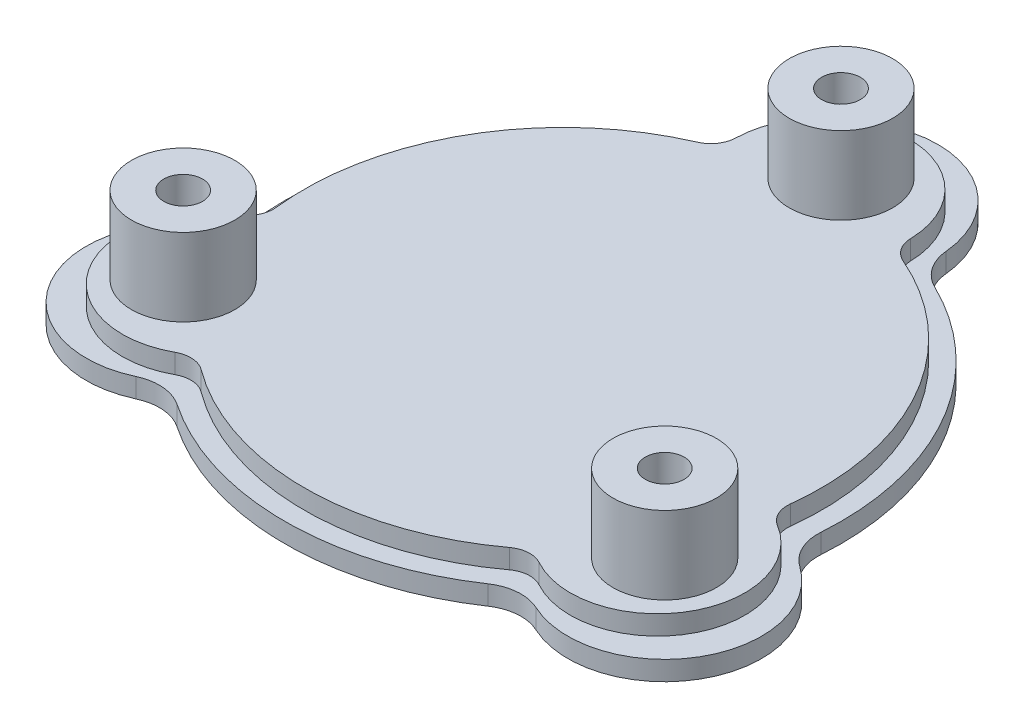
from build123d import *

# Parameters (mm, degrees)
SKETCH1_R           = 6
SKETCH1_R_2         = 3
BOSS_EXTRUDE1_DEPTH = 3
SKETCH3_R           = 3
BOSS_EXTRUDE3_DEPTH = 3
SKETCH4_R           = 8
SKETCH4_R_2         = 3
BOSS_EXTRUDE4_DEPTH = 12
SKETCH6_R           = 8
SKETCH6_R_2         = 3
BOSS_EXTRUDE5_DEPTH = 12


with BuildPart() as part:
    # Sketch1 → Boss-Extrude1 (new body)
    # profile 1 of 4: a face of its own
    with BuildSketch(Plane(origin=(0, 0, 0), x_dir=(1, 0, 0), z_dir=(0, 1, 0))):
        with BuildLine():
            ThreePointArc((42.894958583, -3.003752345), (43.557934635, -6.502479184), (45.856433127, -9.222319513))
            ThreePointArc((45.856433127, -9.222319513), (50.229473419, -29), (30.914979544, -35.101676259))
            ThreePointArc((30.914979544, -35.101676259), (27.410279478, -34.471038339), (24.048805129, -35.646247655))
            ThreePointArc((24.048805129, -35.646247655), (0, -43), (-24.048805129, -35.646247655))
            ThreePointArc((-24.048805129, -35.646247655), (-27.410279478, -34.471038339), (-30.914979544, -35.101676259))
            ThreePointArc((-30.914979544, -35.101676259), (-50.229473419, -29), (-45.856433127, -9.222319513))
            ThreePointArc((-45.856433127, -9.222319513), (-43.557934635, -6.502479184), (-42.894958583, -3.003752345))
            ThreePointArc((-42.894958583, -3.003752345), (-37.239092363, 21.5), (-18.846153454, 38.65))
            ThreePointArc((-18.846153454, 38.65), (-16.147655157, 40.973517523), (-14.941453584, 44.323995772))
            ThreePointArc((-14.941453584, 44.323995772), (0, 58), (14.941453584, 44.323995772))
            ThreePointArc((14.941453584, 44.323995772), (16.147655157, 40.973517523), (18.846153454, 38.65))
            ThreePointArc((18.846153454, 38.65), (37.239092363, 21.5), (42.894958583, -3.003752345))
        make_face()
        with Locations((37.239092363, -21.5)):
            Circle(SKETCH1_R, mode=Mode.SUBTRACT)
        with Locations((-37.239092363, -21.5)):
            Circle(SKETCH1_R, mode=Mode.SUBTRACT)
        with Locations((0, 43)):
            Circle(SKETCH1_R, mode=Mode.SUBTRACT)
    # profile 2 of 4: a face of its own
    with BuildSketch(Plane(origin=(0, 0, 0), x_dir=(1, 0, 0), z_dir=(0, 1, 0))):
        with Locations((-37.239092363, -21.5)):
            Circle(SKETCH1_R)
        with Locations(Location((-37.239092363, -21.5, 0), (0, 0, 270))):
            Circle(SKETCH1_R_2, mode=Mode.SUBTRACT)
    # profile 3 of 4: a face of its own
    with BuildSketch(Plane(origin=(0, 0, 0), x_dir=(1, 0, 0), z_dir=(0, 1, 0))):
        with Locations((37.239092363, -21.5)):
            Circle(SKETCH1_R)
        with Locations(Location((37.239092363, -21.5, 0), (0, 0, 270))):
            Circle(SKETCH1_R_2, mode=Mode.SUBTRACT)
    # profile 4 of 4: a face of its own
    with BuildSketch(Plane(origin=(0, 0, 0), x_dir=(1, 0, 0), z_dir=(0, 1, 0))):
        with Locations((0, 43)):
            Circle(SKETCH1_R)
        with Locations(Location((0, 43, 0), (0, 0, 270))):
            Circle(SKETCH1_R_2, mode=Mode.SUBTRACT)
    extrude(amount=BOSS_EXTRUDE1_DEPTH)

    # Sketch3 → Boss-Extrude3 (add)
    with BuildSketch(Plane(origin=(0, 3, 0), x_dir=(1, 0, 0), z_dir=(0, 1, 0))):
        with BuildLine():
            ThreePointArc((13.496951609, 40.286875), (0, 53.5), (-13.496951609, 40.286875))
            ThreePointArc((-13.496951609, 40.286875), (-14.175747319, 38.14126951), (-15.905498529, 36.701704545))
            ThreePointArc((-15.905498529, 36.701704545), (-34.641016151, 20), (-39.737357763, -4.576286487))
            ThreePointArc((-39.737357763, -4.576286487), (-40.119181988, -6.794077459), (-41.637932994, -8.454734533))
            ThreePointArc((-41.637932994, -8.454734533), (-46.332359102, -26.75), (-28.140981385, -31.832140467))
            ThreePointArc((-28.140981385, -31.832140467), (-25.943434669, -31.347192051), (-23.831859234, -32.125418059))
            ThreePointArc((-23.831859234, -32.125418059), (0, -40), (23.831859234, -32.125418059))
            ThreePointArc((23.831859234, -32.125418059), (25.943434669, -31.347192051), (28.140981385, -31.832140467))
            ThreePointArc((28.140981385, -31.832140467), (46.332359102, -26.75), (41.637932994, -8.454734533))
            ThreePointArc((41.637932994, -8.454734533), (40.119181988, -6.794077459), (39.737357763, -4.576286487))
            ThreePointArc((39.737357763, -4.576286487), (34.641016151, 20), (15.905498529, 36.701704545))
            ThreePointArc((15.905498529, 36.701704545), (14.175747319, 38.14126951), (13.496951609, 40.286875))
        make_face()
        with Locations(Location((0, 43, 0), (0, 0, 270))):
            Circle(SKETCH3_R, mode=Mode.SUBTRACT)
        with Locations(Location((-37.239092363, -21.5, 0), (0, 0, 270))):
            Circle(SKETCH3_R, mode=Mode.SUBTRACT)
        with Locations(Location((37.239092363, -21.5, 0), (0, 0, 270))):
            Circle(SKETCH3_R, mode=Mode.SUBTRACT)
    extrude(amount=BOSS_EXTRUDE3_DEPTH)

    # Sketch4 → Boss-Extrude4 (add)
    with BuildSketch(Plane(origin=(0, 6, 0), x_dir=(1, 0, 0), z_dir=(0, 1, 0))):
        with Locations(Location((0, 43, 0), (0, 0, 270))):
            Circle(SKETCH4_R)
        with Locations(Location((0, 43, 0), (0, 0, 270))):
            Circle(SKETCH4_R_2, mode=Mode.SUBTRACT)
    extrude(amount=BOSS_EXTRUDE4_DEPTH)

    # Sketch6 → Boss-Extrude5 (add)
    # profile 1 of 2: a face of its own
    with BuildSketch(Plane(origin=(0, 6, 0), x_dir=(1, 0, 0), z_dir=(0, 1, 0))):
        with Locations(Location((-37.239092363, -21.5, 0), (0, 0, 270))):
            Circle(SKETCH6_R)
        with Locations(Location((-37.239092363, -21.5, 0), (0, 0, 270))):
            Circle(SKETCH6_R_2, mode=Mode.SUBTRACT)
    # profile 2 of 2: a face of its own
    with BuildSketch(Plane(origin=(0, 6, 0), x_dir=(1, 0, 0), z_dir=(0, 1, 0))):
        with Locations(Location((37.239092363, -21.5, 0), (0, 0, 270))):
            Circle(SKETCH6_R)
        with Locations(Location((37.239092363, -21.5, 0), (0, 0, 270))):
            Circle(SKETCH6_R_2, mode=Mode.SUBTRACT)
    extrude(amount=BOSS_EXTRUDE5_DEPTH)


solid = part.part
